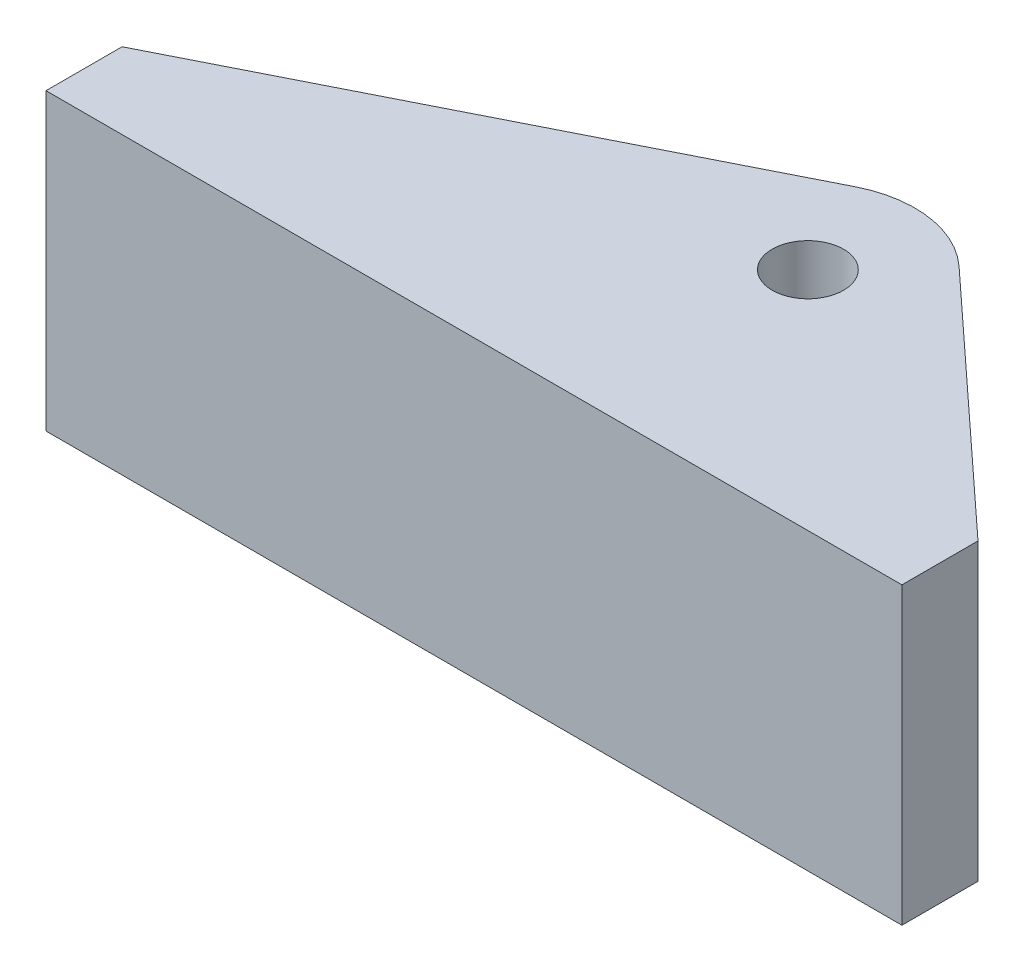
from build123d import *

# Parameters (mm, degrees)
SKETCH1_R           = 2.38125
BOSS_EXTRUDE1_DEPTH = 19.685


with BuildPart() as part:
    # Sketch1 → Boss-Extrude1 (new body)
    with BuildSketch(Plane(origin=(0, 0, 0), x_dir=(1, 0, 0), z_dir=(0, 1, 0))):
        with BuildLine():
            Line((0, 5.08), (32.579112959, 21.463440611))
            ThreePointArc((32.579112959, 21.463440611), (36.78416415, 22.155288174), (40.634925166, 20.329706577))
            Line((40.634925166, 20.329706577), (57.15, 5.08))
            Line((57.15, 5.08), (57.15, 0))
            Line((57.15, 0), (0, 0))
            Line((0, 0), (0, 5.08))
        make_face()
        with Locations(Location((35.7886, 15.08125, 0), (0, 0, 270))):
            Circle(SKETCH1_R, mode=Mode.SUBTRACT)
    extrude(amount=-BOSS_EXTRUDE1_DEPTH)


solid = part.part
